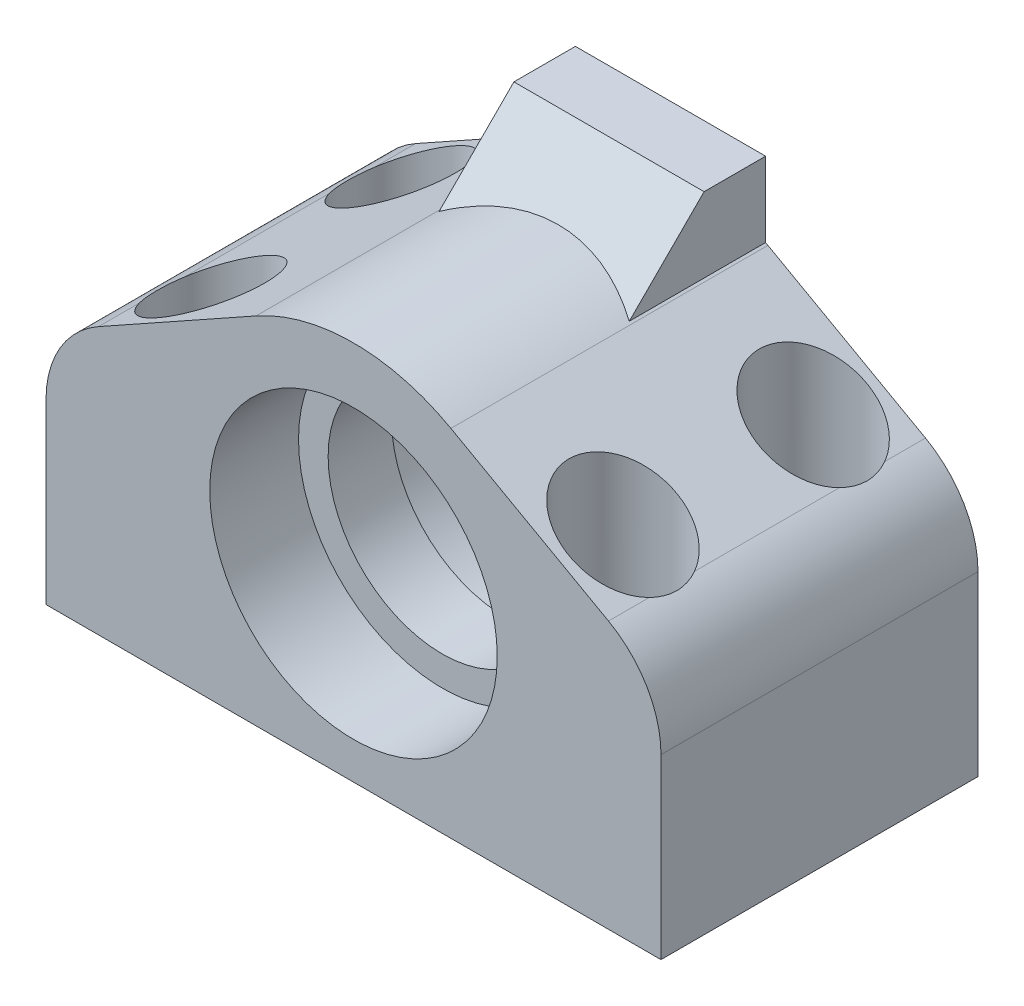
from build123d import *

# Parameters (mm, degrees)
SKETCH1_R           = 9
BOSS_EXTRUDE1_DEPTH = 25
SKETCH2_R           = 11.335
CUT_EXTRUDE1_DEPTH  = 7
CUT_EXTRUDE2_START  = -13
SKETCH3_R           = 11.335
CUT_EXTRUDE2_DEPTH  = 13
BOSS_EXTRUDE2_DEPTH = 4.85
BOSS_EXTRUDE3_DEPTH = 15
SKETCH6_R           = 2.25
CUT_EXTRUDE3_DEPTH  = 49.673016138
SKETCH7_R           = 4.25
CUT_EXTRUDE4_DEPTH  = 43.297310789


with BuildPart() as part:
    # Sketch1 → Boss-Extrude1 (new body)
    with BuildSketch(Plane.XY):
        with BuildLine():
            Line((24.25, 4), (24.25, -10))
            Line((24.25, -10), (-24.25, -10))
            Line((-24.25, -10), (-24.25, 4))
            ThreePointArc((-24.25, 4), (-23.13858198, 8.090248735), (-20.11, 11.055560845))
            Line((-20.11, 11.055560845), (-7.682261614, 17.999376585))
            ThreePointArc((-7.682261614, 17.999376585), (0, 20), (7.682261614, 17.999376585))
            Line((7.682261614, 17.999376585), (20.11, 11.055560845))
            ThreePointArc((20.11, 11.055560845), (23.13858198, 8.090248735), (24.25, 4))
        make_face()
        with Locations((0, 4.25)):
            Circle(SKETCH1_R, mode=Mode.SUBTRACT)
    extrude(amount=BOSS_EXTRUDE1_DEPTH)

    # Sketch2 → Cut-Extrude1 (cut)
    with BuildSketch(Plane.XY.offset(25)):
        with Locations((0, 4.25)):
            Circle(SKETCH2_R)
    extrude(amount=-CUT_EXTRUDE1_DEPTH, mode=Mode.SUBTRACT)

    # Sketch3 → Cut-Extrude2 (cut)
    with BuildSketch(Plane(origin=(0, 0, 0), x_dir=(-1, 0, 0), z_dir=(0, 0, -1)).offset(CUT_EXTRUDE2_START)):
        with Locations(Location((0, 4.25, 0), (0, 0, 180))):
            Circle(SKETCH3_R)
    extrude(amount=CUT_EXTRUDE2_DEPTH, mode=Mode.SUBTRACT)



with BuildPart() as body_2:
    # Sketch4 → Boss-Extrude2 (new body)
    with BuildSketch(Plane(origin=(0, 0, 0), x_dir=(-1, 0, 0), z_dir=(0, 0, -1))):
        with BuildLine():
            Line((-7.5, 18.101212577), (-7.5, 24))
            Line((-7.5, 24), (7.5, 24))
            Line((7.5, 24), (7.5, 18.101212577))
            ThreePointArc((7.5, 18.101212577), (0, 20.001383744), (-7.5, 18.101212577))
        make_face()
    extrude(amount=-BOSS_EXTRUDE2_DEPTH)


with BuildPart() as part_1:
    add(part.part)

    add(body_2.part)  # Boss-Extrude3 merges body 2
    # Sketch5 → Boss-Extrude3 (add)
    with BuildSketch(Plane(origin=(7.5, 0, 0), x_dir=(0, 0, -1), z_dir=(1, 0, 0))):
        Polygon((-4.85, 24), (-4.85, 18.101212577), (-10.748787423, 18.101212577), align=None)
    extrude(amount=-BOSS_EXTRUDE3_DEPTH)

    # Sketch6 → Cut-Extrude3 (cut, through all)
    with BuildSketch(Plane.XZ.offset(10)):
        with Locations((-16.25, 20)):
            Circle(SKETCH6_R)
        with Locations((16.25, 20)):
            Circle(SKETCH6_R)
        with Locations((16.25, 5)):
            Circle(SKETCH6_R)
        with Locations((-16.25, 5)):
            Circle(SKETCH6_R)
    extrude(amount=-CUT_EXTRUDE3_DEPTH, mode=Mode.SUBTRACT)

    # Sketch7 → Cut-Extrude4 (cut, through all)
    with BuildSketch(Plane(origin=(0, 0, 0), x_dir=(-1, 0, 0), z_dir=(0, -1, 0))):
        with Locations(Location((16.25, -20, 0), (0, 0, 180))):
            Circle(SKETCH7_R)
        with Locations(Location((16.25, -5, 0), (0, 0, 180))):
            Circle(SKETCH7_R)
        with Locations(Location((-16.25, -5, 0), (0, 0, 180))):
            Circle(SKETCH7_R)
        with Locations(Location((-16.25, -20, 0), (0, 0, 180))):
            Circle(SKETCH7_R)
    extrude(amount=-CUT_EXTRUDE4_DEPTH, mode=Mode.SUBTRACT)


solid = part_1.part
